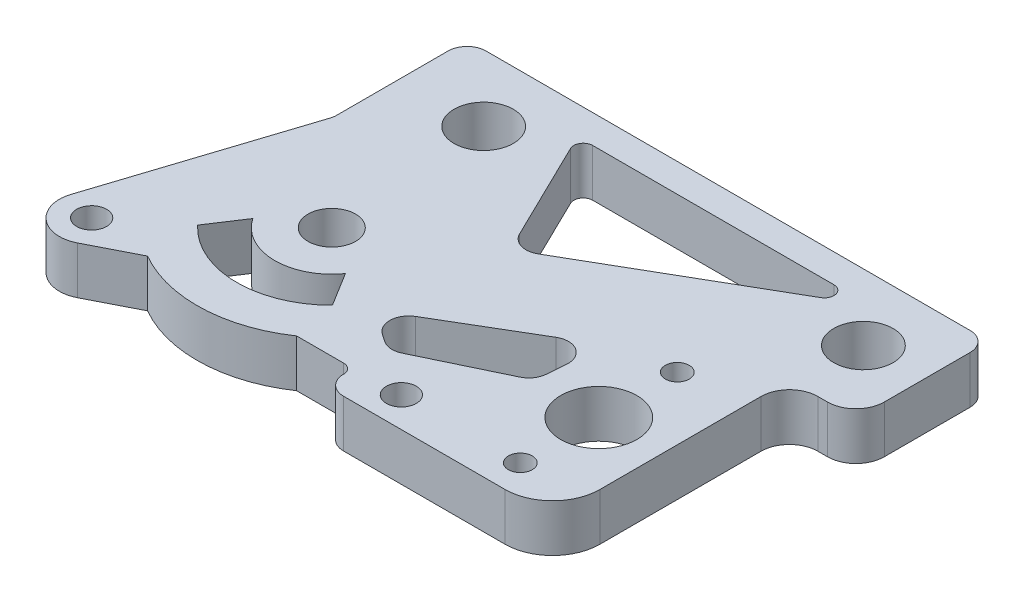
from build123d import *

# Parameters (mm, degrees)
SKETCH4_R           = 3.175
SKETCH4_R_2         = 3.96875
SKETCH4_R_3         = 5.1
SKETCH4_R_4         = 1.6
SKETCH4_R_5         = 2
BOSS_EXTRUDE2_DEPTH = 6.35


with BuildPart() as part:
    # Sketch4 → Boss-Extrude2 (new body)
    with BuildSketch(Plane(origin=(0, 0, 0), x_dir=(1, 0, 0), z_dir=(0, 1, 0))):
        with BuildLine():
            Line((41.886832424, -18.732457737), (20.296832424, -18.732457737))
            ThreePointArc((20.296832424, -18.732457737), (18.500781199, -17.988508961), (17.756832424, -16.192457737))
            Line((17.756832424, -16.192457737), (17.756832424, -16.158228087))
            ThreePointArc((17.756832424, -16.158228087), (17.384858036, -15.260202475), (16.486832424, -14.888228087))
            Line((16.486832424, -14.888228087), (10.176729358, -14.888228087))
            ThreePointArc((10.176729358, -14.888228087), (0.671575018, -18.021491142), (-9.04041606, -15.604359438))
            Line((-9.04041606, -15.604359438), (-15.242136468, -18.768748092))
            ThreePointArc((-15.242136468, -18.768748092), (-20.007104805, -18.207530981), (-21.312082241, -13.59050577))
            Line((-21.312082241, -13.59050577), (-12.82386942, 12.584286272))
            ThreePointArc((-12.82386942, 12.584286272), (-12.731158467, 12.971183794), (-12.7, 13.36781229))
            Line((-12.7, 13.36781229), (-12.7, 28.2575))
            ThreePointArc((-12.7, 28.2575), (-11.956051224, 30.053551224), (-10.16, 30.7975))
            Line((-10.16, 30.7975), (54.61, 30.7975))
            ThreePointArc((54.61, 30.7975), (56.406051224, 30.053551224), (57.15, 28.2575))
            Line((57.15, 28.2575), (57.15, 16.776257881))
            ThreePointArc((57.15, 16.776257881), (56.034076836, 14.082181045), (53.34, 12.966257881))
            Line((53.34, 12.966257881), (52.07, 12.966257881))
            ThreePointArc((52.07, 12.966257881), (49.375923164, 11.850334717), (48.26, 9.156257881))
            Line((48.26, 9.156257881), (48.26, -12.3825))
            ThreePointArc((48.26, -12.3825), (46.391929601, -16.880811578), (41.886832424, -18.732457737))
        make_face()
        with Locations(Location((0, 0, 0), (0, 0, 270))):
            Circle(SKETCH4_R, mode=Mode.SUBTRACT)
        with Locations(Location((-1.5875, 21.9075, 0), (0, 0, 270))):
            Circle(SKETCH4_R_2, mode=Mode.SUBTRACT)
        with Locations(Location((49.2125, 21.9075, 0), (0, 0, 270))):
            Circle(SKETCH4_R_2, mode=Mode.SUBTRACT)
        with Locations(Location((39.848481715, -4.1275, 0), (0, 0, 270))):
            Circle(SKETCH4_R_3, mode=Mode.SUBTRACT)
        with Locations(Location((39.848481715, -14.6275, 0), (0, 0, 270))):
            Circle(SKETCH4_R_4, mode=Mode.SUBTRACT)
        with Locations(Location((39.848481715, 6.3725, 0), (0, 0, 270))):
            Circle(SKETCH4_R_4, mode=Mode.SUBTRACT)
        with Locations(Location((24.012521227, -14.703599027, 0), (0, 0, 270))):
            Circle(SKETCH4_R_5, mode=Mode.SUBTRACT)
        with Locations(Location((-17.204660255, -14.9225, 0), (0, 0, 270))):
            Circle(SKETCH4_R_5, mode=Mode.SUBTRACT)
        with BuildLine():
            Line((40.81829921, 24.617647737), (16.8275, 10.766553356))
            ThreePointArc((16.8275, 10.766553356), (14.81487587, 10.537243801), (13.274563122, 11.852795168))
            Line((13.274563122, 11.852795168), (6.783830771, 25.160768644))
            ThreePointArc((6.783830771, 25.160768644), (6.848278127, 26.390497466), (7.92529921, 26.9875))
            Line((7.92529921, 26.9875), (40.18329921, 26.9875))
            ThreePointArc((40.18329921, 26.9875), (41.410025009, 26.046200187), (40.81829921, 24.617647737))
        make_face(mode=Mode.SUBTRACT)
        with BuildLine():
            Line((31.325699228, -2.62693366), (31.523640252, -0.070720194))
            ThreePointArc((31.523640252, -0.070720194), (30.334503757, 2.281113068), (27.699320049, 2.312291862))
            Line((27.699320049, 2.312291862), (15.869577834, -4.676031684))
            ThreePointArc((15.869577834, -4.676031684), (14.622916882, -6.777495975), (15.725443447, -8.958035098))
            Line((15.725443447, -8.958035098), (16.699675668, -9.625802289))
            ThreePointArc((16.699675668, -9.625802289), (17.939612893, -10.063131328), (19.232094548, -9.821900773))
            Line((19.232094548, -9.821900773), (29.889663519, -4.722023501))
            ThreePointArc((29.889663519, -4.722023501), (30.888370189, -3.866870885), (31.325699228, -2.62693366))
        make_face(mode=Mode.SUBTRACT)
        with BuildLine():
            Line((6.222926422, -4.3976797), (9.022181232, -8.938134359))
            ThreePointArc((9.022181232, -8.938134359), (-0.187421307, -12.698616982), (-9.282033212, -8.667978971))
            Line((-9.282033212, -8.667978971), (-6.35, -4.212113484))
            ThreePointArc((-6.35, -4.212113484), (-0.112452784, -7.619170189), (6.222926422, -4.3976797))
        make_face(mode=Mode.SUBTRACT)
    extrude(amount=-BOSS_EXTRUDE2_DEPTH)


solid = part.part
